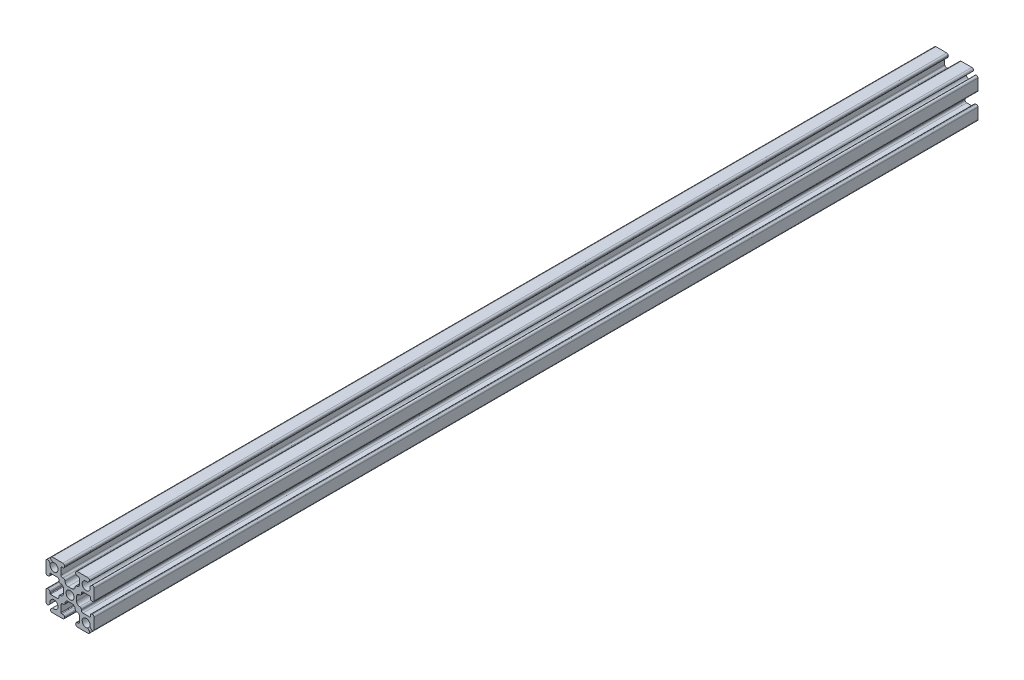
from build123d import *

# Parameters (mm, degrees)
SKETCH1_R           = 1.25
BOSS_EXTRUDE1_DEPTH = 424.19
SKETCH2_W           = 19.128008286
SKETCH2_H           = 35.887875157
CUT_EXTRUDE1_DEPTH  = 147.32
SKETCH3_W           = 55.04352993
SKETCH3_H           = 66.308311026
CUT_EXTRUDE2_DEPTH  = 1.77


with BuildPart() as part:
    # Sketch1 → Boss-Extrude1 (new body)
    with BuildSketch(Plane.XY):
        with BuildLine():
            Line((6.646446609, 5.939339828), (6.163645978, 5.456539197))
            ThreePointArc((6.163645978, 5.456539197), (4.116116524, 4.116116524), (5.456539197, 6.163645978))
            Line((5.456539197, 6.163645978), (5.939339828, 6.646446609))
            ThreePointArc((5.939339828, 6.646446609), (6.047726204, 7.191341716), (5.585786438, 7.5))
            Line((5.585786438, 7.5), (2.25, 7.5))
            ThreePointArc((2.25, 7.5), (1.896446609, 7.353553391), (1.75, 7))
            Line((1.75, 7), (1.75, 6.8))
            ThreePointArc((1.75, 6.8), (1.896446609, 6.446446609), (2.25, 6.3))
            Line((2.25, 6.3), (2.65, 6.3))
            ThreePointArc((2.65, 6.3), (2.791421356, 6.241421356), (2.85, 6.1))
            Line((2.85, 6.1), (2.85, 4))
            ThreePointArc((2.85, 4), (2.703553391, 3.646446609), (2.35, 3.5))
            Line((2.35, 3.5), (2.1, 3.5))
            ThreePointArc((2.1, 3.5), (1.746446609, 3.353553391), (1.6, 3))
            ThreePointArc((1.6, 3), (1.307106781, 2.292893219), (0.6, 2))
            Line((0.6, 2), (-0.6, 2))
            ThreePointArc((-0.6, 2), (-1.307106781, 2.292893219), (-1.6, 3))
            ThreePointArc((-1.6, 3), (-1.746446609, 3.353553391), (-2.1, 3.5))
            Line((-2.1, 3.5), (-2.35, 3.5))
            ThreePointArc((-2.35, 3.5), (-2.703553391, 3.646446609), (-2.85, 4))
            Line((-2.85, 4), (-2.85, 6.1))
            ThreePointArc((-2.85, 6.1), (-2.791421356, 6.241421356), (-2.65, 6.3))
            Line((-2.65, 6.3), (-2.25, 6.3))
            ThreePointArc((-2.25, 6.3), (-1.896446609, 6.446446609), (-1.75, 6.8))
            Line((-1.75, 6.8), (-1.75, 7))
            ThreePointArc((-1.75, 7), (-1.896446609, 7.353553391), (-2.25, 7.5))
            Line((-2.25, 7.5), (-5.585786438, 7.5))
            ThreePointArc((-5.585786438, 7.5), (-6.047726204, 7.191341716), (-5.939339828, 6.646446609))
            Line((-5.939339828, 6.646446609), (-5.456539197, 6.163645978))
            ThreePointArc((-5.456539197, 6.163645978), (-4.116116524, 4.116116524), (-6.163645978, 5.456539197))
            Line((-6.163645978, 5.456539197), (-6.646446609, 5.939339828))
            ThreePointArc((-6.646446609, 5.939339828), (-7.191341716, 6.047726204), (-7.5, 5.585786438))
            Line((-7.5, 5.585786438), (-7.5, 2.25))
            ThreePointArc((-7.5, 2.25), (-7.353553391, 1.896446609), (-7, 1.75))
            Line((-7, 1.75), (-6.8, 1.75))
            ThreePointArc((-6.8, 1.75), (-6.446446609, 1.896446609), (-6.3, 2.25))
            Line((-6.3, 2.25), (-6.3, 2.65))
            ThreePointArc((-6.3, 2.65), (-6.241421356, 2.791421356), (-6.1, 2.85))
            Line((-6.1, 2.85), (-4, 2.85))
            ThreePointArc((-4, 2.85), (-3.646446609, 2.703553391), (-3.5, 2.35))
            Line((-3.5, 2.35), (-3.5, 2.1))
            ThreePointArc((-3.5, 2.1), (-3.353553391, 1.746446609), (-3, 1.6))
            ThreePointArc((-3, 1.6), (-2.292893219, 1.307106781), (-2, 0.6))
            Line((-2, 0.6), (-2, -0.6))
            ThreePointArc((-2, -0.6), (-2.292893219, -1.307106781), (-3, -1.6))
            ThreePointArc((-3, -1.6), (-3.353553391, -1.746446609), (-3.5, -2.1))
            Line((-3.5, -2.1), (-3.5, -2.35))
            ThreePointArc((-3.5, -2.35), (-3.646446609, -2.703553391), (-4, -2.85))
            Line((-4, -2.85), (-6.1, -2.85))
            ThreePointArc((-6.1, -2.85), (-6.241421356, -2.791421356), (-6.3, -2.65))
            Line((-6.3, -2.65), (-6.3, -2.25))
            ThreePointArc((-6.3, -2.25), (-6.446446609, -1.896446609), (-6.8, -1.75))
            Line((-6.8, -1.75), (-7, -1.75))
            ThreePointArc((-7, -1.75), (-7.353553391, -1.896446609), (-7.5, -2.25))
            Line((-7.5, -2.25), (-7.5, -5.585786438))
            ThreePointArc((-7.5, -5.585786438), (-7.191341716, -6.047726204), (-6.646446609, -5.939339828))
            Line((-6.646446609, -5.939339828), (-6.163645978, -5.456539197))
            ThreePointArc((-6.163645978, -5.456539197), (-4.116116524, -4.116116524), (-5.456539197, -6.163645978))
            Line((-5.456539197, -6.163645978), (-5.939339828, -6.646446609))
            ThreePointArc((-5.939339828, -6.646446609), (-6.047726204, -7.191341716), (-5.585786438, -7.5))
            Line((-5.585786438, -7.5), (-2.25, -7.5))
            ThreePointArc((-2.25, -7.5), (-1.896446609, -7.353553391), (-1.75, -7))
            Line((-1.75, -7), (-1.75, -6.8))
            ThreePointArc((-1.75, -6.8), (-1.896446609, -6.446446609), (-2.25, -6.3))
            Line((-2.25, -6.3), (-2.65, -6.3))
            ThreePointArc((-2.65, -6.3), (-2.791421356, -6.241421356), (-2.85, -6.1))
            Line((-2.85, -6.1), (-2.85, -4))
            ThreePointArc((-2.85, -4), (-2.703553391, -3.646446609), (-2.35, -3.5))
            Line((-2.35, -3.5), (-2.1, -3.5))
            ThreePointArc((-2.1, -3.5), (-1.746446609, -3.353553391), (-1.6, -3))
            ThreePointArc((-1.6, -3), (-1.307106781, -2.292893219), (-0.6, -2))
            Line((-0.6, -2), (0.6, -2))
            ThreePointArc((0.6, -2), (1.307106781, -2.292893219), (1.6, -3))
            ThreePointArc((1.6, -3), (1.746446609, -3.353553391), (2.1, -3.5))
            Line((2.1, -3.5), (2.35, -3.5))
            ThreePointArc((2.35, -3.5), (2.703553391, -3.646446609), (2.85, -4))
            Line((2.85, -4), (2.85, -6.1))
            ThreePointArc((2.85, -6.1), (2.791421356, -6.241421356), (2.65, -6.3))
            Line((2.65, -6.3), (2.25, -6.3))
            ThreePointArc((2.25, -6.3), (1.896446609, -6.446446609), (1.75, -6.8))
            Line((1.75, -6.8), (1.75, -7))
            ThreePointArc((1.75, -7), (1.896446609, -7.353553391), (2.25, -7.5))
            Line((2.25, -7.5), (5.585786438, -7.5))
            ThreePointArc((5.585786438, -7.5), (6.047726204, -7.191341716), (5.939339828, -6.646446609))
            Line((5.939339828, -6.646446609), (5.456539197, -6.163645978))
            ThreePointArc((5.456539197, -6.163645978), (4.116116524, -4.116116524), (6.163645978, -5.456539197))
            Line((6.163645978, -5.456539197), (6.646446609, -5.939339828))
            ThreePointArc((6.646446609, -5.939339828), (7.191341716, -6.047726204), (7.5, -5.585786438))
            Line((7.5, -5.585786438), (7.5, -2.25))
            ThreePointArc((7.5, -2.25), (7.353553391, -1.896446609), (7, -1.75))
            Line((7, -1.75), (6.8, -1.75))
            ThreePointArc((6.8, -1.75), (6.446446609, -1.896446609), (6.3, -2.25))
            Line((6.3, -2.25), (6.3, -2.65))
            ThreePointArc((6.3, -2.65), (6.241421356, -2.791421356), (6.1, -2.85))
            Line((6.1, -2.85), (4, -2.85))
            ThreePointArc((4, -2.85), (3.646446609, -2.703553391), (3.5, -2.35))
            Line((3.5, -2.35), (3.5, -2.1))
            ThreePointArc((3.5, -2.1), (3.353553391, -1.746446609), (3, -1.6))
            ThreePointArc((3, -1.6), (2.292893219, -1.307106781), (2, -0.6))
            Line((2, -0.6), (2, 0.6))
            ThreePointArc((2, 0.6), (2.292893219, 1.307106781), (3, 1.6))
            ThreePointArc((3, 1.6), (3.353553391, 1.746446609), (3.5, 2.1))
            Line((3.5, 2.1), (3.5, 2.35))
            ThreePointArc((3.5, 2.35), (3.646446609, 2.703553391), (4, 2.85))
            Line((4, 2.85), (6.1, 2.85))
            ThreePointArc((6.1, 2.85), (6.241421356, 2.791421356), (6.3, 2.65))
            Line((6.3, 2.65), (6.3, 2.25))
            ThreePointArc((6.3, 2.25), (6.446446609, 1.896446609), (6.8, 1.75))
            Line((6.8, 1.75), (7, 1.75))
            ThreePointArc((7, 1.75), (7.353553391, 1.896446609), (7.5, 2.25))
            Line((7.5, 2.25), (7.5, 5.585786438))
            ThreePointArc((7.5, 5.585786438), (7.191341716, 6.047726204), (6.646446609, 5.939339828))
        make_face()
        with Locations(Location((0, 0, 0), (0, 0, 180))):
            Circle(SKETCH1_R, mode=Mode.SUBTRACT)
    extrude(amount=BOSS_EXTRUDE1_DEPTH)

    # Sketch2 → Cut-Extrude1 (cut)
    with BuildSketch(Plane(origin=(0, 0, 0), x_dir=(-1, 0, 0), z_dir=(0, 0, -1))):
        with Locations((-1.40638356, 2.865806024)):
            Rectangle(SKETCH2_W, SKETCH2_H)
    extrude(amount=-CUT_EXTRUDE1_DEPTH, mode=Mode.SUBTRACT)

    # Sketch3 → Cut-Extrude2 (cut)
    with BuildSketch(Plane(origin=(0, 0, 147.32), x_dir=(-1, 0, 0), z_dir=(0, 0, -1))):
        with Locations((0.214436434, 3.671610739)):
            Rectangle(SKETCH3_W, SKETCH3_H)
    extrude(amount=-CUT_EXTRUDE2_DEPTH, mode=Mode.SUBTRACT)


solid = part.part
